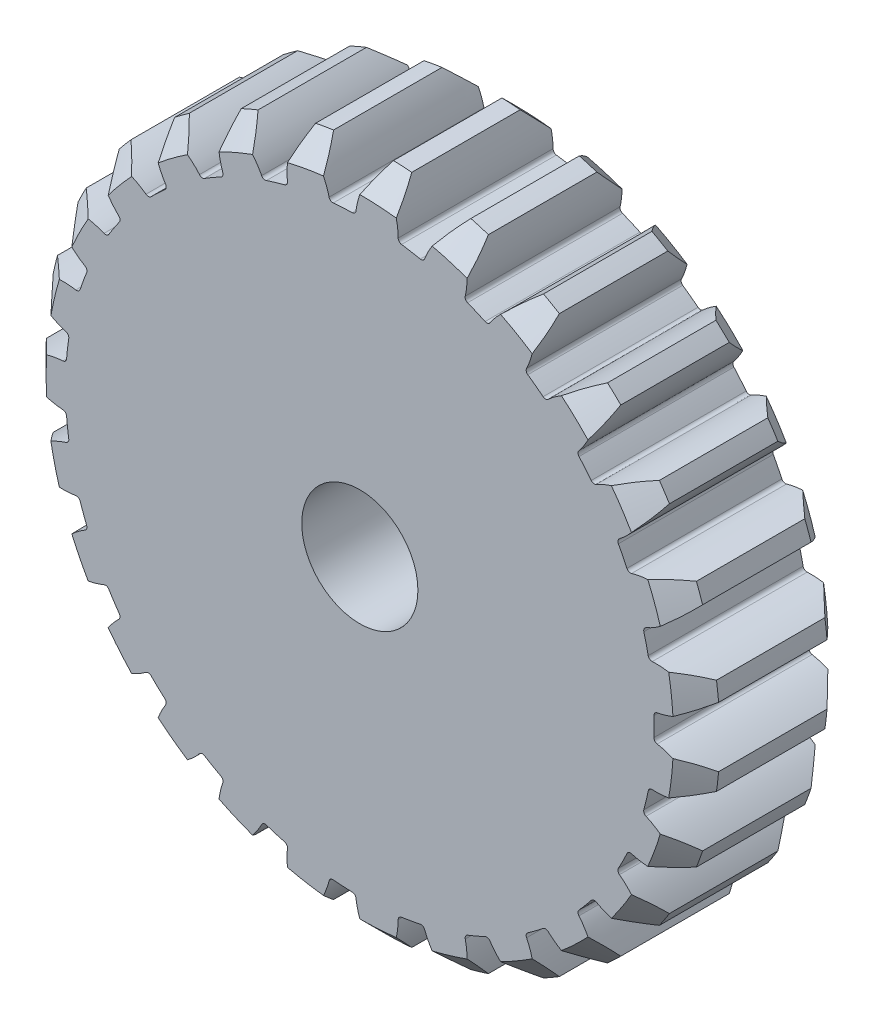
from build123d import *

# Parameters (mm, degrees)
SCHIZZO1_R                           = 43.5
SCHIZZO1_R_2                         = 7.5
ESTRUSIONE_ESTRUSIONE1_DEPTH         = 20
TAGLIO_ESTRUSIONE1_DEPTH             = 20
RACCORDO1_R                          = 0.5
SMUSSO1_SIZE                         = 3
RIPETIZIONECIRCOLARE1_COUNT          = 27
RACCORDO1_OF_RIPETIZIONECIRCOLARE1_R = 0.5


with BuildPart() as part:
    # Schizzo1 → Estrusione-Estrusione1 (new body)
    with BuildSketch(Plane.XY):
        Circle(SCHIZZO1_R)
        Circle(SCHIZZO1_R_2, mode=Mode.SUBTRACT)
    extrude(amount=ESTRUSIONE_ESTRUSIONE1_DEPTH)

    # Schizzo2 → Taglio-Estrusione1 (cut)
    with BuildSketch(Plane.XY.offset(20)):
        with BuildLine():
            ThreePointArc((37.962544447, -1.686777724), (38, 0), (37.962544447, 1.686777724))
            add(Edge.make_bspline(
                [(37.962544447, 1.686777724), (37.998646582, 1.688381839), (38.070732745, 1.69312144), (38.214430924, 1.708817095), (38.50014337, 1.752889859), (38.875299387, 1.832558179), (39.336516259, 1.957255422), (39.969903227, 2.164130891), (40.627136367, 2.420914381), (41.31839154, 2.73383955), (42.203474556, 3.189537127), (43.136767448, 3.735374431), (43.883802741, 4.232931846), (44.460701268, 4.65273334), (44.736601228, 4.861739463)],
                knots=[0, 0, 0, 0, 0, 0.000700508, 0.001401017, 0.002802034, 0.005604068, 0.008132613, 0.010661158, 0.015718248, 0.019278665, 0.022839082, 0.029959916, 0.036671856, 0.036671856, 0.036671856, 0.036671856, 0.036671856], degree=4))
            ThreePointArc((44.736601228, 4.861739463), (45, 0), (44.736601228, -4.861739463))
            add(Edge.make_bspline(
                [(37.962544447, -1.686777724), (37.998646582, -1.688381839), (38.070732745, -1.69312144), (38.214430924, -1.708817095), (38.50014337, -1.752889859), (38.875299387, -1.832558179), (39.336516259, -1.957255422), (39.969903227, -2.164130891), (40.627136367, -2.420914381), (41.31839154, -2.73383955), (42.203474556, -3.189537127), (43.136767448, -3.735374431), (43.883802741, -4.232931846), (44.460701268, -4.65273334), (44.736601228, -4.861739463)],
                knots=[0, 0, 0, 0, 0, 0.000700508, 0.001401017, 0.002802034, 0.005604068, 0.008132613, 0.010661158, 0.015718248, 0.019278665, 0.022839082, 0.029959916, 0.036671856, 0.036671856, 0.036671856, 0.036671856, 0.036671856], degree=4))
        make_face()
    taglio_estrusione1 = extrude(amount=-TAGLIO_ESTRUSIONE1_DEPTH, mode=Mode.SUBTRACT)

    # Raccordo1
    raccordo1_edges = [part.edges().sort_by_distance(p)[0] for p in [
        (37.962544447, 1.686777724, 10),
        (37.962544447, -1.686777724, 10),
    ]]
    fillet(raccordo1_edges, radius=RACCORDO1_R)

    # Smusso1
    smusso1_edges = [part.edges().sort_by_distance(p)[0] for p in [
        (-43.5, 0, 0),
        (-43.5, 0, 20),
    ]]
    chamfer(smusso1_edges, length=SMUSSO1_SIZE)

    # RipetizioneCircolare1: Taglio-Estrusione1 ×27 about axis
    ripetizionecircolare1_axis = Axis((0, 0, 20), (0, 0, -1))
    for i in range(1, RIPETIZIONECIRCOLARE1_COUNT):
        add(taglio_estrusione1.rotate(ripetizionecircolare1_axis, i * 360 / RIPETIZIONECIRCOLARE1_COUNT), mode=Mode.SUBTRACT)

    # Raccordo1 of RipetizioneCircolare1
    raccordo1_of_ripetizionecircolare1_edges = [part.edges().sort_by_distance(p)[0] for p in [
        (37.328256862, -7.113454831, 10),
        (36.550261435, -10.396075656, 10),
        (34.681593288, -15.530199195, 10),
        (33.167544368, -18.544918458, 10),
        (30.165236042, -23.1097065, 10),
        (27.996756399, -25.693999905, 10),
        (24.022663113, -29.443363547, 10),
        (21.316656046, -31.457911168, 10),
        (16.585022198, -34.189721243, 10),
        (13.487369248, -35.525918296, 10),
        (8.253278443, -37.092902218, 10),
        (4.930974882, -37.678713974, 10),
        (-0.523401688, -37.996395233, 10),
        (-3.891249615, -37.800240428, 10),
        (-9.2718651, -36.851492745, 10),
        (-12.503695839, -35.883946137, 10),
        (-17.520479864, -33.719916746, 10),
        (-20.442064583, -32.033139021, 10),
        (-24.824561023, -28.770491306, 10),
        (-27.278396335, -26.45541709, 10),
        (-30.790343672, -22.270041233, 10),
        (-32.644142679, -19.451476775, 10),
        (-35.096210924, -14.569007473, 10),
        (-36.250034842, -11.398902312, 10),
        (-37.510032361, -6.082554749, 10),
        (-37.901678244, -2.731810076, 10),
        (-37.901678244, 2.731810076, 10),
        (-37.510032361, 6.082554749, 10),
        (-36.250034842, 11.398902312, 10),
        (-35.096210924, 14.569007473, 10),
        (-32.644142679, 19.451476775, 10),
        (-30.790343672, 22.270041233, 10),
        (-27.278396335, 26.45541709, 10),
        (-24.824561023, 28.770491306, 10),
        (-20.442064583, 32.033139021, 10),
        (-17.520479864, 33.719916746, 10),
        (-12.503695839, 35.883946137, 10),
        (-9.2718651, 36.851492745, 10),
        (-3.891249615, 37.800240428, 10),
        (-0.523401688, 37.996395233, 10),
        (4.930974882, 37.678713974, 10),
        (8.253278443, 37.092902218, 10),
        (13.487369248, 35.525918296, 10),
        (16.585022198, 34.189721243, 10),
        (21.316656046, 31.457911168, 10),
        (24.022663113, 29.443363547, 10),
        (27.996756399, 25.693999905, 10),
        (30.165236042, 23.1097065, 10),
        (33.167544368, 18.544918458, 10),
        (34.681593288, 15.530199195, 10),
        (36.550261435, 10.396075656, 10),
        (37.328256862, 7.113454831, 10),
    ]]
    fillet(raccordo1_of_ripetizionecircolare1_edges, radius=RACCORDO1_OF_RIPETIZIONECIRCOLARE1_R)


solid = part.part
